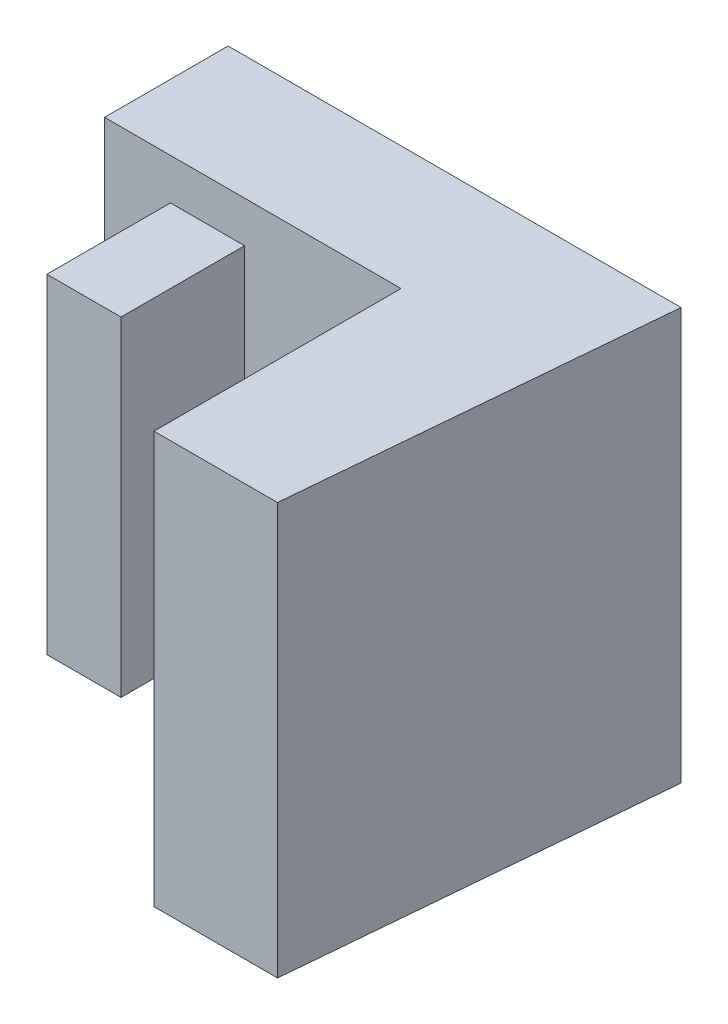
from build123d import *

# Parameters (mm, degrees)
BOSS_EXTRUDE1_DEPTH = 10
SKETCH2_W           = 1.8
SKETCH2_H           = 8
BOSS_EXTRUDE2_DEPTH = 3


with BuildPart() as part:
    # Sketch1 → Boss-Extrude1 (new body)
    with BuildSketch(Plane(origin=(0, 0, 0), x_dir=(1, 0, 0), z_dir=(0, 1, 0))):
        Polygon((0, 0), (7.2, 0), (7.2, -6), (10.2, -6), (11, 3), (0, 3), align=None)
    extrude(amount=BOSS_EXTRUDE1_DEPTH)

    # Sketch2 → Boss-Extrude2 (add)
    with BuildSketch(Plane.XY):
        with Locations((2.5, 5)):
            Rectangle(SKETCH2_W, SKETCH2_H)
    extrude(amount=BOSS_EXTRUDE2_DEPTH)


solid = part.part
